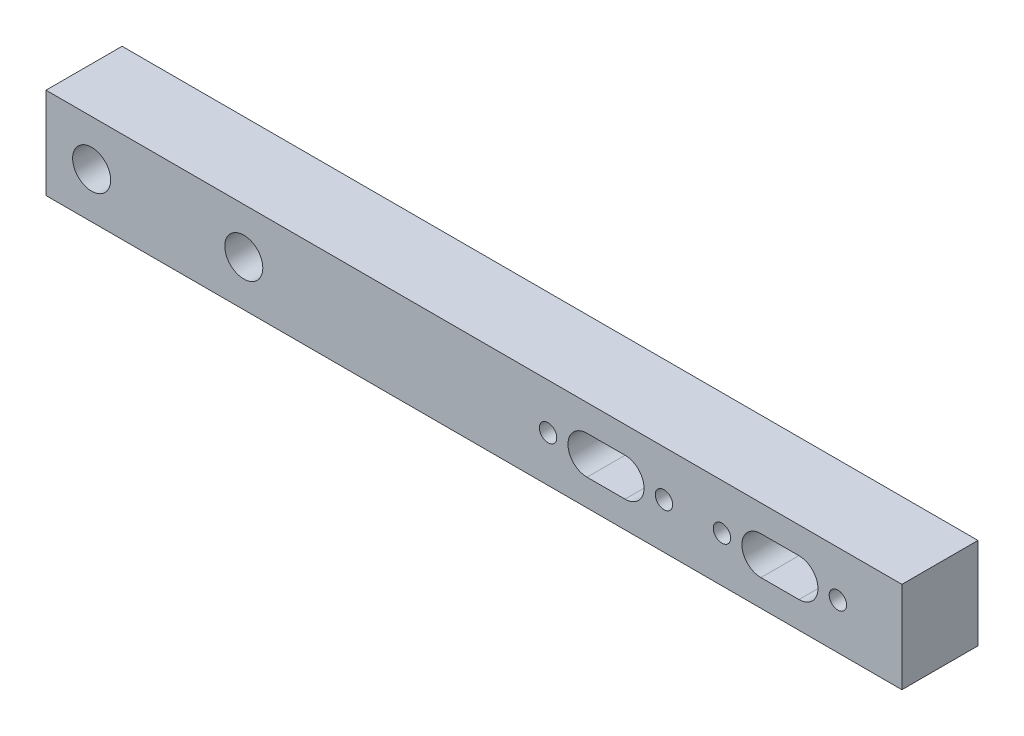
from build123d import *

# Parameters (mm, degrees)
SKETCH1_W           = 112.520086359
SKETCH1_H           = 12
SKETCH1_R           = 2.5
SKETCH1_R_2         = 1.143
BOSS_EXTRUDE1_DEPTH = 10


with BuildPart() as part:
    # Sketch1 → Boss-Extrude1 (new body)
    with BuildSketch(Plane.XY):
        with Locations((-99.282747956, 73.19632446)):
            Rectangle(SKETCH1_W, SKETCH1_H)
        with Locations((-149.542791135, 73.19632446)):
            Circle(SKETCH1_R, mode=Mode.SUBTRACT)
        with Locations((-129.542791135, 73.19632446)):
            Circle(SKETCH1_R, mode=Mode.SUBTRACT)
        with Locations((-89.542791135, 73.19632446)):
            Circle(SKETCH1_R_2, mode=Mode.SUBTRACT)
        with Locations((-74.302791135, 73.19632446)):
            Circle(SKETCH1_R_2, mode=Mode.SUBTRACT)
        with Locations((-66.682791135, 73.19632446)):
            Circle(SKETCH1_R_2, mode=Mode.SUBTRACT)
        with Locations((-51.442791135, 73.19632446)):
            Circle(SKETCH1_R_2, mode=Mode.SUBTRACT)
        with BuildLine():
            Line((-84.422791135, 75.69632446), (-79.422791135, 75.69632446))
            ThreePointArc((-79.422791135, 75.69632446), (-76.922791135, 73.19632446), (-79.422791135, 70.69632446))
            Line((-79.422791135, 70.69632446), (-84.422791135, 70.69632446))
            ThreePointArc((-84.422791135, 70.69632446), (-86.922791135, 73.19632446), (-84.422791135, 75.69632446))
        make_face(mode=Mode.SUBTRACT)
        with BuildLine():
            Line((-61.562791135, 75.69632446), (-56.562791135, 75.69632446))
            ThreePointArc((-56.562791135, 75.69632446), (-54.062791135, 73.19632446), (-56.562791135, 70.69632446))
            Line((-56.562791135, 70.69632446), (-61.562791135, 70.69632446))
            ThreePointArc((-61.562791135, 70.69632446), (-64.062791135, 73.19632446), (-61.562791135, 75.69632446))
        make_face(mode=Mode.SUBTRACT)
    extrude(amount=BOSS_EXTRUDE1_DEPTH)


solid = part.part
